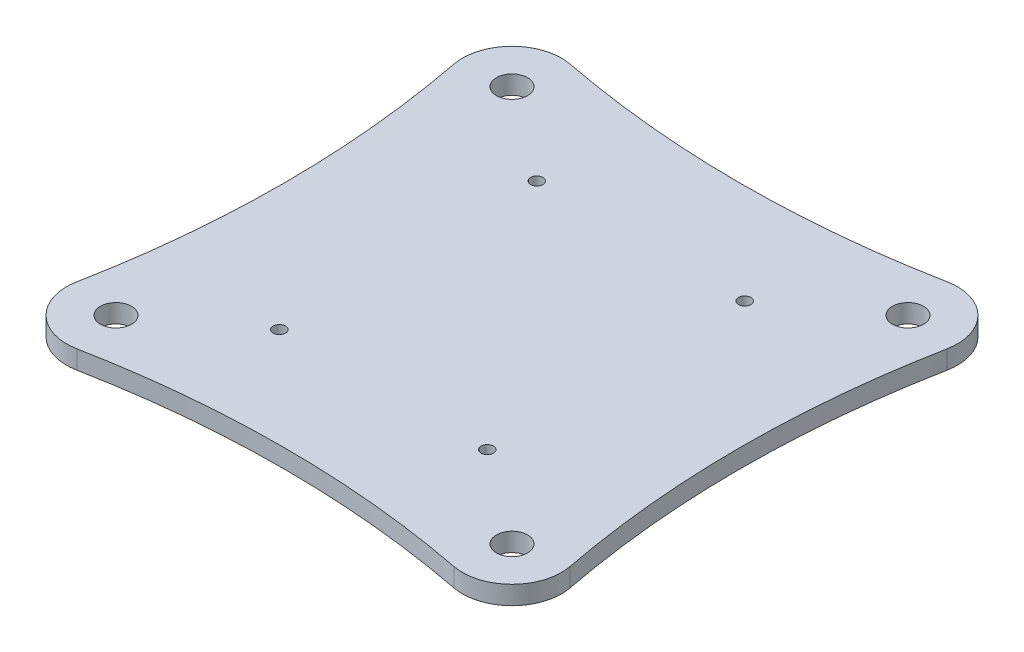
from build123d import *

# Parameters (mm, degrees)
SKETCH1_R           = 4
SKETCH1_R_2         = 1.5875
BOSS_EXTRUDE1_DEPTH = 4.7625


with BuildPart() as part:
    # Sketch1 → Boss-Extrude1 (new body)
    with BuildSketch(Plane(origin=(0, 0, 0), x_dir=(1, 0, 0), z_dir=(0, 1, 0))):
        with BuildLine():
            ThreePointArc((-48.380952381, 63.267486058), (-59.780256121, 59.780256121), (-63.267486058, 48.380952381))
            ThreePointArc((-63.267486058, 48.380952381), (-58.617207227, 0), (-63.267486058, -48.380952381))
            ThreePointArc((-63.267486058, -48.380952381), (-59.780256121, -59.780256121), (-48.380952381, -63.267486058))
            ThreePointArc((-48.380952381, -63.267486058), (0, -58.617207227), (48.380952381, -63.267486058))
            ThreePointArc((48.380952381, -63.267486058), (59.780256121, -59.780256121), (63.267486058, -48.380952381))
            ThreePointArc((63.267486058, -48.380952381), (58.617207227, 0), (63.267486058, 48.380952381))
            ThreePointArc((63.267486058, 48.380952381), (59.780256121, 59.780256121), (48.380952381, 63.267486058))
            ThreePointArc((48.380952381, 63.267486058), (0, 58.617207227), (-48.380952381, 63.267486058))
        make_face()
        with Locations(Location((-50.8, 50.8, 0), (0, 0, 90))):
            Circle(SKETCH1_R, mode=Mode.SUBTRACT)
        with Locations(Location((50.8, 50.8, 0), (0, 0, 90))):
            Circle(SKETCH1_R, mode=Mode.SUBTRACT)
        with Locations(Location((50.8, -50.8, 0), (0, 0, 90))):
            Circle(SKETCH1_R, mode=Mode.SUBTRACT)
        with Locations(Location((-50.8, -50.8, 0), (0, 0, 90))):
            Circle(SKETCH1_R, mode=Mode.SUBTRACT)
        with Locations(Location((-26.67, 33.02, 0), (0, 0, 90))):
            Circle(SKETCH1_R_2, mode=Mode.SUBTRACT)
        with Locations(Location((26.67, 33.02, 0), (0, 0, 90))):
            Circle(SKETCH1_R_2, mode=Mode.SUBTRACT)
        with Locations(Location((-26.67, -33.02, 0), (0, 0, 90))):
            Circle(SKETCH1_R_2, mode=Mode.SUBTRACT)
        with Locations(Location((26.67, -33.02, 0), (0, 0, 90))):
            Circle(SKETCH1_R_2, mode=Mode.SUBTRACT)
    extrude(amount=BOSS_EXTRUDE1_DEPTH)


solid = part.part
